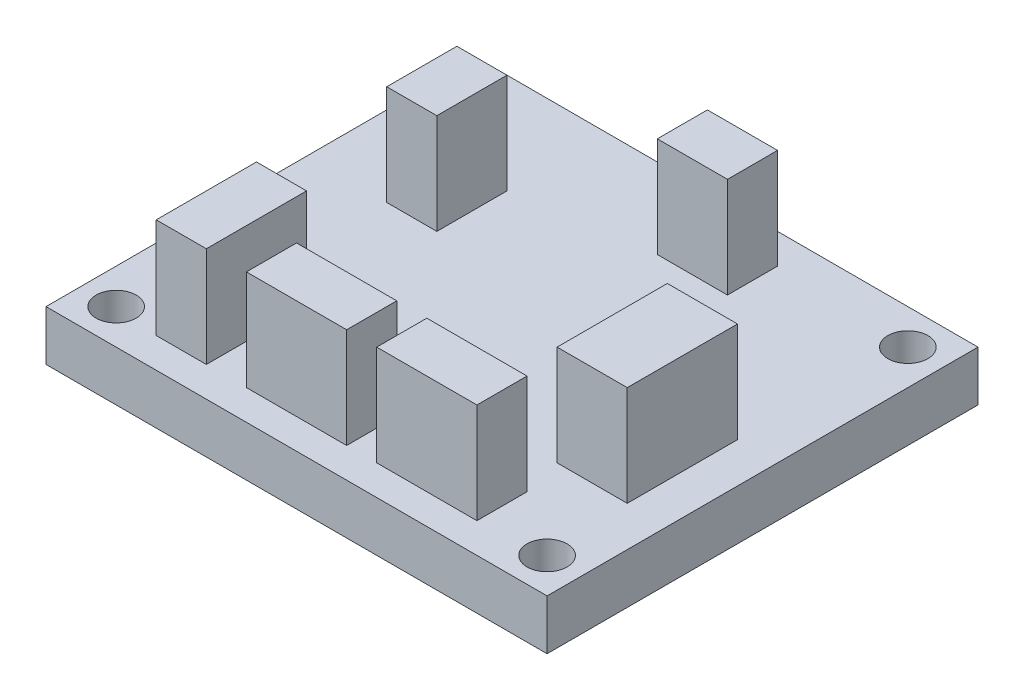
from build123d import *

# Parameters (mm, degrees)
ESQUISSE1_W        = 50
ESQUISSE1_H        = 43
ESQUISSE1_R        = 2
BOSS_EXTRU_1_DEPTH = 5
ESQUISSE2_W        = 5
ESQUISSE2_H        = 10
ESQUISSE2_H_2      = 7
ESQUISSE2_W_2      = 7
ESQUISSE2_H_3      = 5
ESQUISSE2_H_4      = 11
ESQUISSE2_W_3      = 10
BOSS_EXTRU_2_DEPTH = 15


with BuildPart() as part:
    # Esquisse1 → Boss.-Extru.1 (new body)
    with BuildSketch(Plane(origin=(0, 0, 0), x_dir=(1, 0, 0), z_dir=(0, 1, 0))):
        Rectangle(ESQUISSE1_W, ESQUISSE1_H)
        with Locations(Location((-21.5, 18, 0), (0, 0, 270))):
            Circle(ESQUISSE1_R, mode=Mode.SUBTRACT)
        with Locations(Location((21.5, 18, 0), (0, 0, 90))):
            Circle(ESQUISSE1_R, mode=Mode.SUBTRACT)
        with Locations(Location((21.5, -18, 0), (0, 0, 270))):
            Circle(ESQUISSE1_R, mode=Mode.SUBTRACT)
        with Locations(Location((-21.5, -18, 0), (0, 0, 90))):
            Circle(ESQUISSE1_R, mode=Mode.SUBTRACT)
    extrude(amount=BOSS_EXTRU_1_DEPTH)

    # Esquisse2 → Boss.-Extru.2 (add)
    with BuildSketch(Plane(origin=(0, 0, 0), x_dir=(1, 0, 0), z_dir=(0, 1, 0))):
        with Locations((-14.5, -13.5)):
            Rectangle(ESQUISSE2_W, ESQUISSE2_H)
        with Locations((-14.5, 8)):
            Rectangle(ESQUISSE2_W, ESQUISSE2_H_2)
        with Locations((4.5, 16)):
            Rectangle(ESQUISSE2_W_2, ESQUISSE2_H_3)
        with Locations((17.5, -4)):
            Rectangle(ESQUISSE2_W_2, ESQUISSE2_H_4)
        with Locations((10, -16)):
            Rectangle(ESQUISSE2_W_3, ESQUISSE2_H_3)
        with Locations((-3, -16)):
            Rectangle(ESQUISSE2_W_3, ESQUISSE2_H_3)
    extrude(amount=BOSS_EXTRU_2_DEPTH)


solid = part.part
